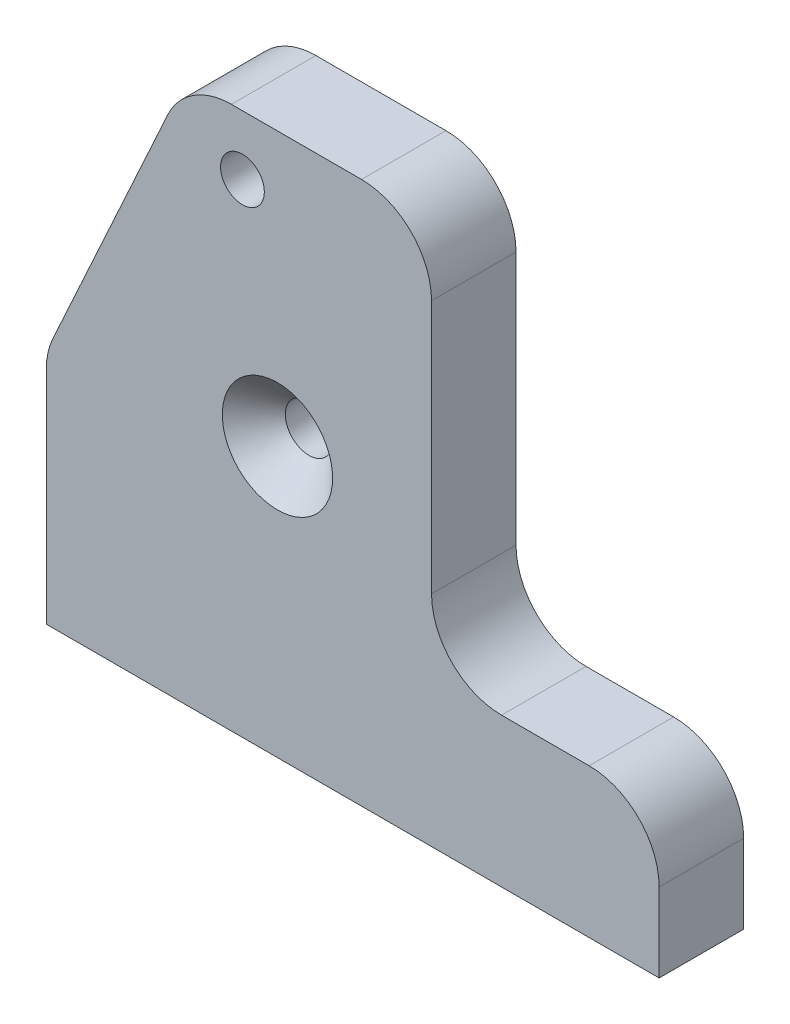
from build123d import *

# Parameters (mm, degrees)
BOSS_EXTRUDE1_DEPTH                             = 4.826
M3X0_5_TAPPED_HOLE2_D                           = 2.5
M3X0_5_TAPPED_HOLE3_D                           = 2.5
M3X0_5_TAPPED_HOLE3_DEPTH                       = 5
M3X0_5_TAPPED_HOLE3_TIP                         = 0.751075774
FILLET2_R                                       = 4
SKETCH19_R                                      = 1.25
CUT_EXTRUDE1_DEPTH                              = 10
CSK_FOR_M3_FLAT_HEAD_MACHINE_SCREW1_D           = 2.7
CSK_FOR_M3_FLAT_HEAD_MACHINE_SCREW1_CSINK_D     = 6.3
CSK_FOR_M3_FLAT_HEAD_MACHINE_SCREW1_CSINK_ANGLE = 90


with BuildPart() as part:
    # Sketch1 → Boss-Extrude1 (new body)
    with BuildSketch(Plane.XY):
        Polygon((0, 0), (0, 13.5), (8, 31), (22, 31), (22, 8.5), (35, 8.5), (35, 0), align=None)
    extrude(amount=BOSS_EXTRUDE1_DEPTH)

    # M3x0.5 Tapped Hole2 (through all)
    with Locations(Plane.XY.offset(4.826)):
        with Locations((11.2, 27.6)):
            Hole(M3X0_5_TAPPED_HOLE2_D / 2)

    # M3x0.5 Tapped Hole3
    with Locations(Plane(origin=(0, 0, 0), x_dir=(-1, 0, 0), z_dir=(0, -1, 0))):
        with Locations((-16.73, -2.413), (-28.73, -2.413)):
            Hole(M3X0_5_TAPPED_HOLE3_D / 2, depth=M3X0_5_TAPPED_HOLE3_DEPTH)
            with Locations((0, 0, -(M3X0_5_TAPPED_HOLE3_DEPTH + M3X0_5_TAPPED_HOLE3_TIP / 2))):  # 118° drill point
                Cone(0, M3X0_5_TAPPED_HOLE3_D / 2, M3X0_5_TAPPED_HOLE3_TIP, mode=Mode.SUBTRACT)

    # Fillet2
    fillet2_edges = [part.edges().sort_by_distance(p)[0] for p in [
        (22, 31, 2.413),
        (22, 8.5, 2.413),
        (35, 8.5, 2.413),
        (0, 13.5, 2.413),
        (8, 31, 2.413),
    ]]
    fillet(fillet2_edges, radius=FILLET2_R)

    # Sketch19 → Cut-Extrude1 (cut)
    with BuildSketch(Plane.XY.offset(4.826)):
        with Locations((13.2, 15.4)):
            Circle(SKETCH19_R)
    extrude(amount=-CUT_EXTRUDE1_DEPTH, mode=Mode.SUBTRACT)

    # CSK for M3 Flat Head Machine Screw1 (through all)
    with Locations(Plane.XY.offset(4.826)):
        with Locations((13.2, 15.4)):
            CounterSinkHole(CSK_FOR_M3_FLAT_HEAD_MACHINE_SCREW1_D / 2, CSK_FOR_M3_FLAT_HEAD_MACHINE_SCREW1_CSINK_D / 2, counter_sink_angle=CSK_FOR_M3_FLAT_HEAD_MACHINE_SCREW1_CSINK_ANGLE)


solid = part.part
